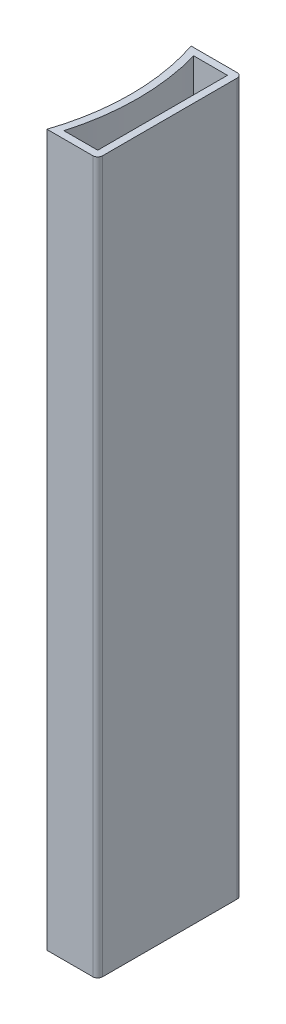
from build123d import *

# Parameters (mm, degrees)
BOSS_EXTRUDE1_DEPTH = 148
FILLET1_R           = 1
SHELL1_T            = -1.5


with BuildPart() as part:
    # Sketch1 → Boss-Extrude1 (new body)
    with BuildSketch(Plane(origin=(0, 0, 0), x_dir=(1, 0, 0), z_dir=(0, 1, 0))):
        with BuildLine():
            Line((0, 0), (10.57, 0))
            Line((10.57, 0), (10.57, -30))
            Line((10.57, -30), (0, -30))
            ThreePointArc((0, -30), (2.434164903, -15), (0, 0))
        make_face()
    extrude(amount=BOSS_EXTRUDE1_DEPTH)

    # Fillet1
    fillet1_edges = [part.edges().sort_by_distance(p)[0] for p in [
        (10.57, 74, 0),
        (10.57, 74, 30),
    ]]
    fillet(fillet1_edges, radius=FILLET1_R)

    # Shell1
    shell1_openings = [part.faces().sort_by_distance(p)[0] for p in [
        (6.064557182, 148, 15),
        (6.064557182, 0, 15),
    ]]
    offset(amount=SHELL1_T, openings=shell1_openings, kind=Kind.INTERSECTION)


solid = part.part
